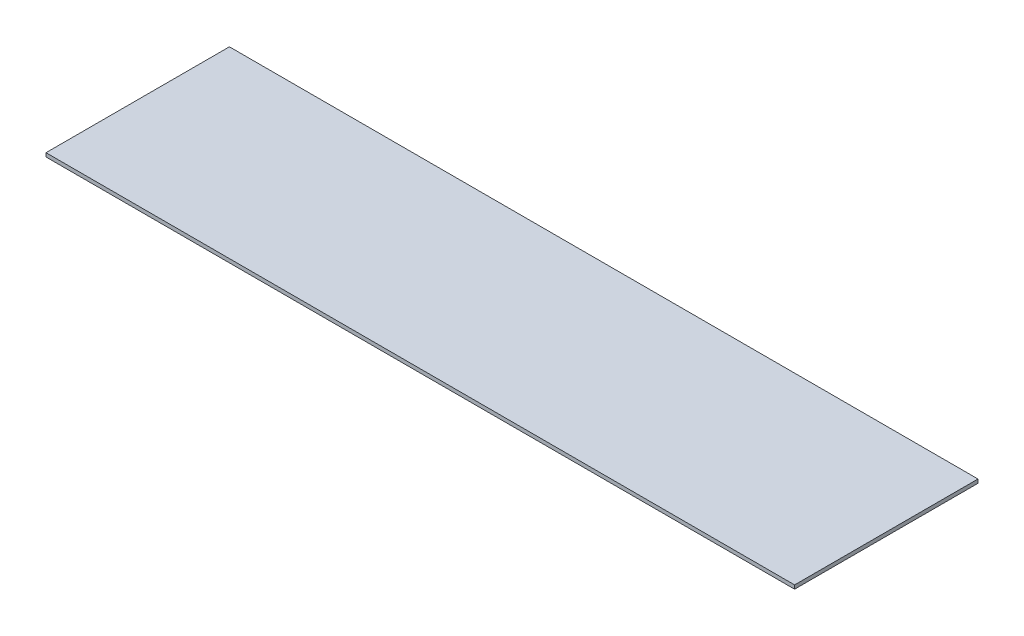
from build123d import *

# Parameters (mm, degrees)
SKETCH1_W           = 98
SKETCH1_H           = 2
BOSS_EXTRUDE1_DEPTH = 400


with BuildPart() as part:
    # Sketch1 → Boss-Extrude1 (new body)
    with BuildSketch(Plane(origin=(0, 0, 0), x_dir=(0, 0, -1), z_dir=(1, 0, 0))):
        with Locations((49, 1)):
            Rectangle(SKETCH1_W, SKETCH1_H)
    extrude(amount=BOSS_EXTRUDE1_DEPTH)


solid = part.part
